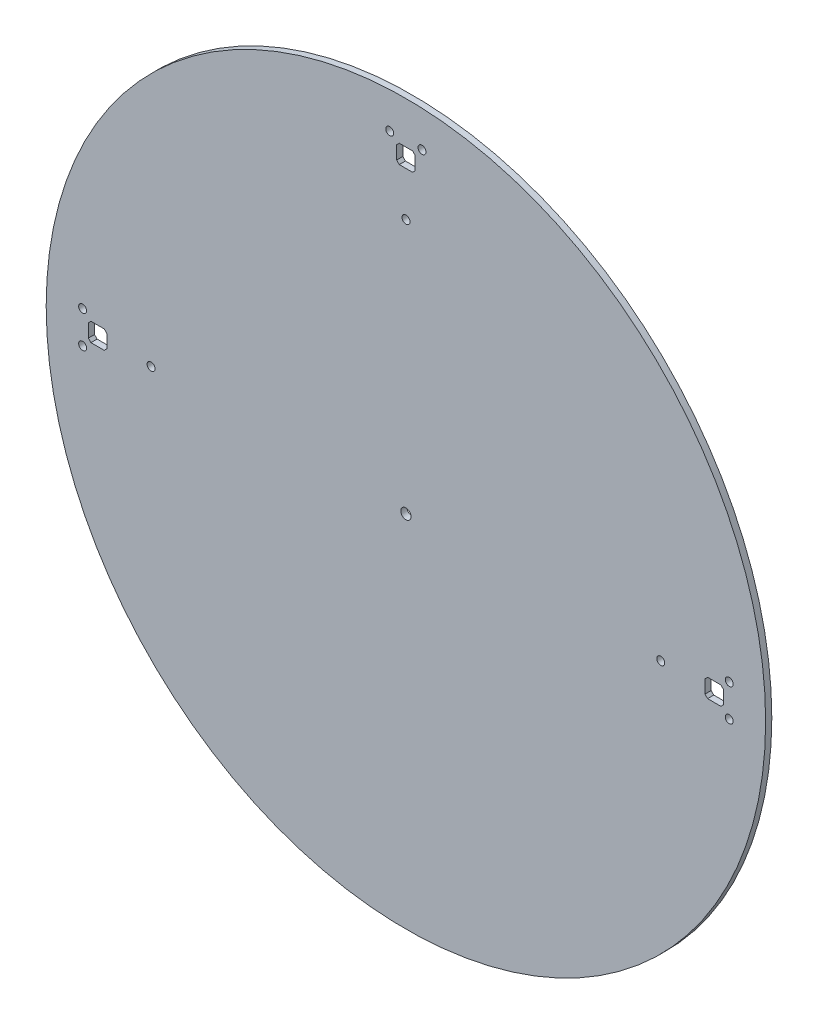
from build123d import *

# Parameters (mm, degrees)
SKETCH1_R           = 350
SKETCH1_R_2         = 3.853599608
BOSS_EXTRUDE1_DEPTH = 6
SKETCH3_R           = 5
CUT_EXTRUDE1_DEPTH  = 23


with BuildPart() as part:
    # Sketch1 → Boss-Extrude1 (new body)
    with BuildSketch(Plane.XY):
        Circle(SKETCH1_R)
        with Locations((-15.75089486, 314.549698435)):
            Circle(SKETCH1_R_2, mode=Mode.SUBTRACT)
        with Locations((15.650361768, 314.54857996)):
            Circle(SKETCH1_R_2, mode=Mode.SUBTRACT)
        with Locations((0.100305228, 247.936525061)):
            Circle(SKETCH1_R_2, mode=Mode.SUBTRACT)
        with Locations((-314.54747334, -15.780069307)):
            Circle(SKETCH1_R_2, mode=Mode.SUBTRACT)
        with Locations((-314.546354865, 15.621187321)):
            Circle(SKETCH1_R_2, mode=Mode.SUBTRACT)
        with Locations((-247.934299965, 0.071130781)):
            Circle(SKETCH1_R_2, mode=Mode.SUBTRACT)
        with Locations(Location((247.926914103, 0.099183743, 0), (0, 0, 180))):
            Circle(SKETCH1_R_2, mode=Mode.SUBTRACT)
        with Locations(Location((314.538969003, 15.649240284, 0), (0, 0, 180))):
            Circle(SKETCH1_R_2, mode=Mode.SUBTRACT)
        with Locations(Location((314.540087478, -15.752016345, 0), (0, 0, 180))):
            Circle(SKETCH1_R_2, mode=Mode.SUBTRACT)
        Polygon((9.000621865, 306.449460756), (9.000621865, 293.529460756), (6.460621865, 290.989460756), (-6.459378135, 290.989460756), (-8.999378135, 293.529460756), (-8.999378135, 306.449460756), (-6.459378135, 308.989460756), (6.460621865, 308.989460756), align=None, mode=Mode.SUBTRACT)
        Polygon((-306.44723566, 8.971447418), (-293.52723566, 8.971447418), (-290.98723566, 6.431447418), (-290.98723566, -6.488552582), (-293.52723566, -9.028552582), (-306.44723566, -9.028552582), (-308.98723566, -6.488552582), (-308.98723566, 6.431447418), align=None, mode=Mode.SUBTRACT)
        Polygon((308.979849798, 6.459500381), (306.439849798, 8.999500381), (293.519849798, 8.999500381), (290.979849798, 6.459500381), (290.979849798, -6.460499619), (293.519849798, -9.000499619), (306.439849798, -9.000499619), (308.979849798, -6.460499619), align=None, mode=Mode.SUBTRACT)
    extrude(amount=BOSS_EXTRUDE1_DEPTH)

    # Sketch3 → Cut-Extrude1 (cut)
    with BuildSketch(Plane.XY.offset(6)):
        Circle(SKETCH3_R)
    extrude(amount=-CUT_EXTRUDE1_DEPTH, mode=Mode.SUBTRACT)


solid = part.part
